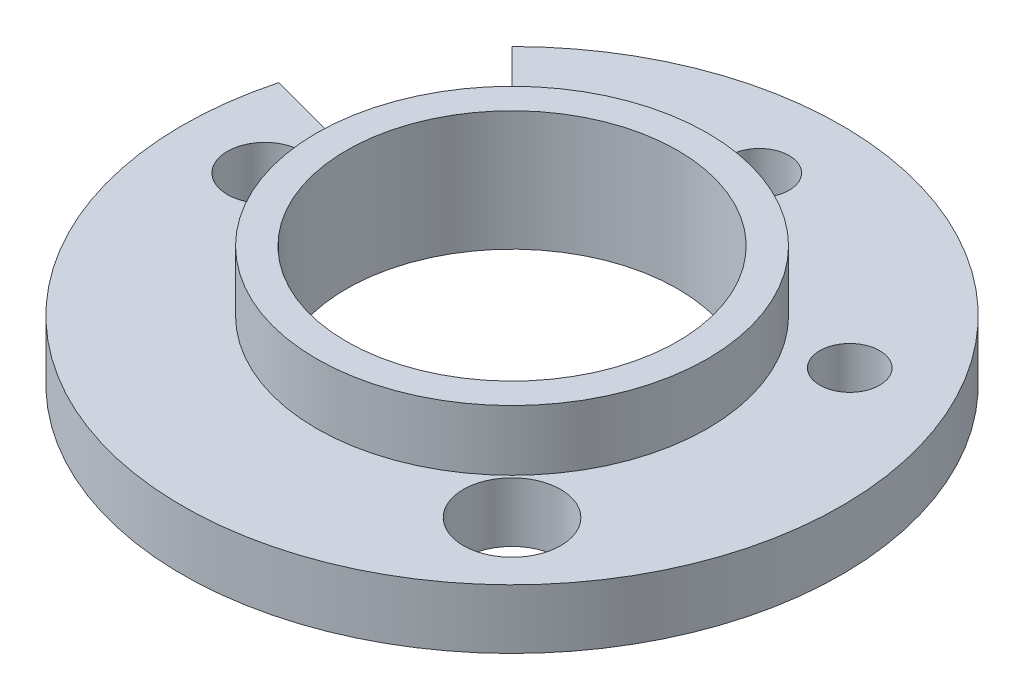
from build123d import *

# Parameters (mm, degrees)
SKETCH3_R          = 2.5
SKETCH3_R_2        = 3.25
SKETCH3_R_3        = 2
CUT_EXTRUDE1_DEPTH = 10


with BuildPart() as part:
    # Sketch1 → Revolve1 (revolve)
    with BuildSketch(Plane.XY, mode=Mode.PRIVATE) as revolve1_sk:
        Polygon((11.05, 0), (11.05, 8), (13.05, 8), (13.05, 3.969255392), (22, 3.969255392), (22, 0), align=None)
    revolve(revolve1_sk.sketch.rotate(Axis((0, 0, 0), (0, 1, 0)), 90), axis=Axis((0, 0, 0), (0, 1, 0)))

    # Sketch3 → Cut-Extrude1 (cut)
    with BuildSketch(Plane(origin=(0, 0, 0), x_dir=(1, 0, 0), z_dir=(0, 1, 0))):
        with Locations(Location((-16.5, 0, 0), (0, 0, 270))):
            Circle(SKETCH3_R)
        with Locations(Location((11.66726189, -11.66726189, 0), (0, 0, 270))):
            Circle(SKETCH3_R_2)
        with Locations(Location((14.289419162, 8.25, 0), (0, 0, 270))):
            Circle(SKETCH3_R_3)
        with Locations(Location((0, 16.5, 0), (0, 0, 270))):
            Circle(SKETCH3_R_3)
        with BuildLine():
            Line((-16.442045207, 16.442045207), (-9.269550975, 9.269550975))
            ThreePointArc((-9.269550975, 9.269550975), (-11.352835017, 6.554562353), (-12.662442113, 3.392891138))
            Line((-12.662442113, 3.392891138), (-22.460251443, 6.018206236))
            ThreePointArc((-22.460251443, 6.018206236), (-20.137310542, 11.626281662), (-16.442045207, 16.442045207))
        make_face()
    extrude(amount=CUT_EXTRUDE1_DEPTH, mode=Mode.SUBTRACT)


solid = part.part
